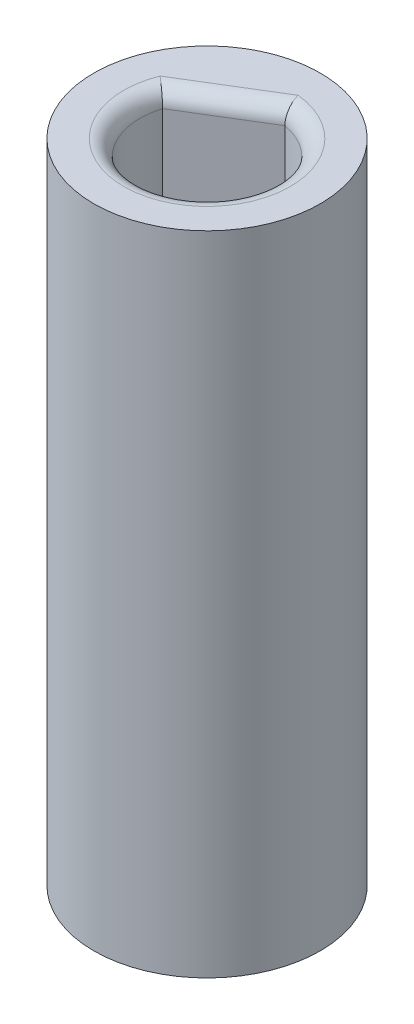
from build123d import *

# Parameters (mm, degrees)
SKETCH1_R           = 7
BOSS_EXTRUDE1_DEPTH = 40
FILLET1_R           = 1
SKETCH2_R           = 4.15
BOSS_EXTRUDE2_DEPTH = 10


with BuildPart() as part:
    # Sketch1 → Boss-Extrude1 (new body)
    with BuildSketch(Plane(origin=(0, 0, 0), x_dir=(1, 0, 0), z_dir=(0, 1, 0))):
        with Locations(Location((0, 0, 0), (0, 0, 270))):
            Circle(SKETCH1_R)
        with BuildLine():
            Line((-3.967096862, 1.218459063), (0.726242752, 4.085960287))
            ThreePointArc((0.726242752, 4.085960287), (2.163660014, -3.541338072), (-3.967096862, 1.218459063))
        make_face(mode=Mode.SUBTRACT)
    extrude(amount=BOSS_EXTRUDE1_DEPTH)

    # Fillet1
    fillet1_edges = [part.edges().sort_by_distance(p)[0] for p in [
        (-1.620427055, 40, -2.652209675),
        (2.163660014, 40, 3.541338072),
    ]]
    fillet(fillet1_edges, radius=FILLET1_R)

    # Sketch2 → Boss-Extrude2 (add)
    with BuildSketch(Plane.XZ):
        Circle(SKETCH2_R)
    extrude(amount=-BOSS_EXTRUDE2_DEPTH)


solid = part.part
